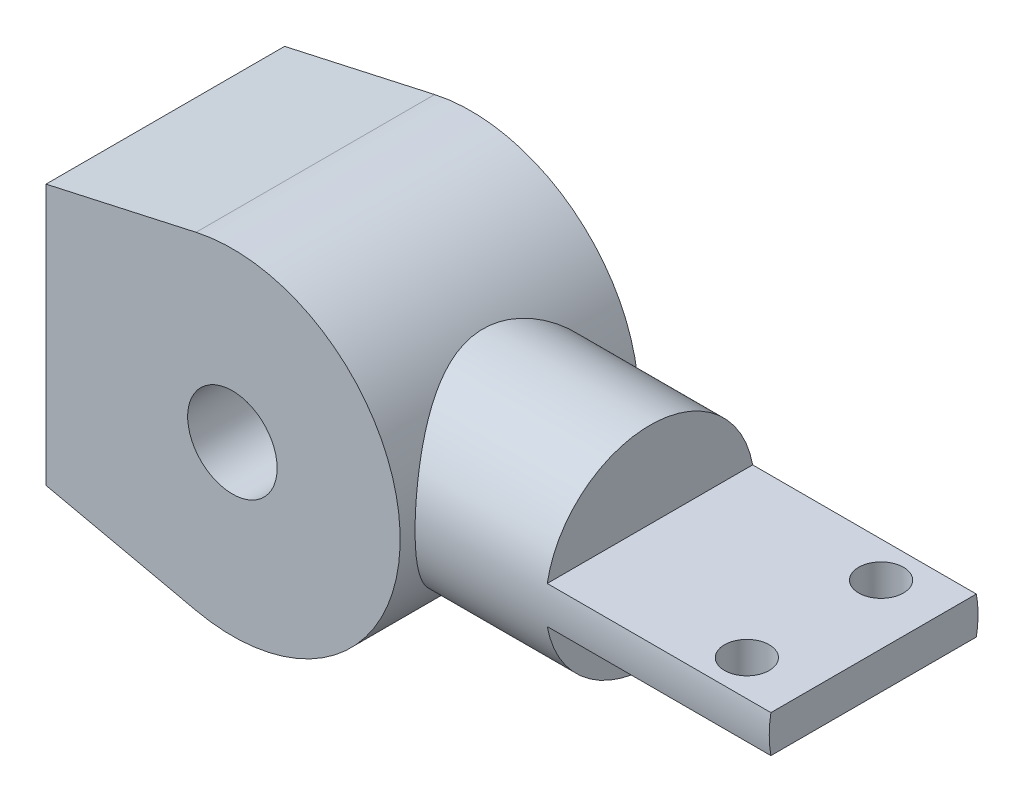
from build123d import *

# Parameters (mm, degrees)
IZIM1_R                          = 6
Y_KSEKLIK_EKSTR_ZYON1_DEPTH      = 16
Y_KSEKLIK_EKSTR_ZYON2_REACH      = 72.62
Y_KSEKLIK_EKSTR_ZYON2_END_RADIUS = 22.5
IZIM2_R                          = 14
Y_KSEKLIK_EKSTR_ZYON3_START      = 30
Y_KSEKLIK_EKSTR_ZYON3_DEPTH      = 30
IZIM4_R                          = 3
KES_EKSTR_ZYON1_DEPTH            = 30


with BuildPart() as part:
    # Çizim1 → Yükseklik-Ekstrüzyon1 (new, symmetric)
    with BuildSketch(Plane.XY):
        with BuildLine():
            Line((-25, 17.5), (-25, -17.5))
            Line((-25, -17.5), (-4.873971328, -21.965755245))
            ThreePointArc((-4.873971328, -21.965755245), (22.5, 0), (-4.873971328, 21.965755245))
            Line((-4.873971328, 21.965755245), (-25, 17.5))
        make_face()
        Circle(IZIM1_R, mode=Mode.SUBTRACT)
    extrude(amount=Y_KSEKLIK_EKSTR_ZYON1_DEPTH, both=True)

    # Yükseklik-Ekstrüzyon2: up to this cylinder (the profile starts outside it)
    y_kseklik_ekstr_zyon2_end = Plane(origin=(0, 0, 0), z_dir=(0, 0, -1)) * Cylinder(Y_KSEKLIK_EKSTR_ZYON2_END_RADIUS, 191.24, mode=Mode.PRIVATE)
    # Çizim2 → Yükseklik-Ekstrüzyon2 (add, up to the surface)
    with BuildSketch(Plane(origin=(40, 0, 0), x_dir=(0, 0, -1), z_dir=(1, 0, 0)), mode=Mode.PRIVATE) as y_kseklik_ekstr_zyon2_sk1:
        Circle(IZIM2_R)
    y_kseklik_ekstr_zyon2_tool1 = extrude(y_kseklik_ekstr_zyon2_sk1.sketch, amount=-Y_KSEKLIK_EKSTR_ZYON2_REACH, mode=Mode.PRIVATE) - y_kseklik_ekstr_zyon2_end
    add(y_kseklik_ekstr_zyon2_tool1.solids().sort_by_distance((40, 0, 0))[0])

    # Çizim3 → Yükseklik-Ekstrüzyon3 (add)
    with BuildSketch(Plane(origin=(40, 0, 0), x_dir=(0, 0, -1), z_dir=(1, 0, 0)).offset(Y_KSEKLIK_EKSTR_ZYON3_START)):
        with BuildLine():
            ThreePointArc((-13.774977314, 2.5), (-14, 0), (-13.774977314, -2.5))
            Line((-13.774977314, -2.5), (13.774977314, -2.5))
            ThreePointArc((13.774977314, -2.5), (13.943630847, -1.255053307), (14, 0))
            ThreePointArc((14, 0), (13.943630847, 1.255053307), (13.774977314, 2.5))
            Line((13.774977314, 2.5), (-13.774977314, 2.5))
        make_face()
    extrude(amount=-Y_KSEKLIK_EKSTR_ZYON3_DEPTH)

    # Çizim4 → Kes-Ekstrüzyon1 (cut)
    with BuildSketch(Plane(origin=(0, 2.5, 0), x_dir=(1, 0, 0), z_dir=(0, 1, 0))):
        with Locations(Location((62, -9, 0), (0, 0, 270))):
            Circle(IZIM4_R)
        with Locations(Location((62, 9, 0), (0, 0, 270))):
            Circle(IZIM4_R)
    extrude(amount=-KES_EKSTR_ZYON1_DEPTH, mode=Mode.SUBTRACT)


solid = part.part
